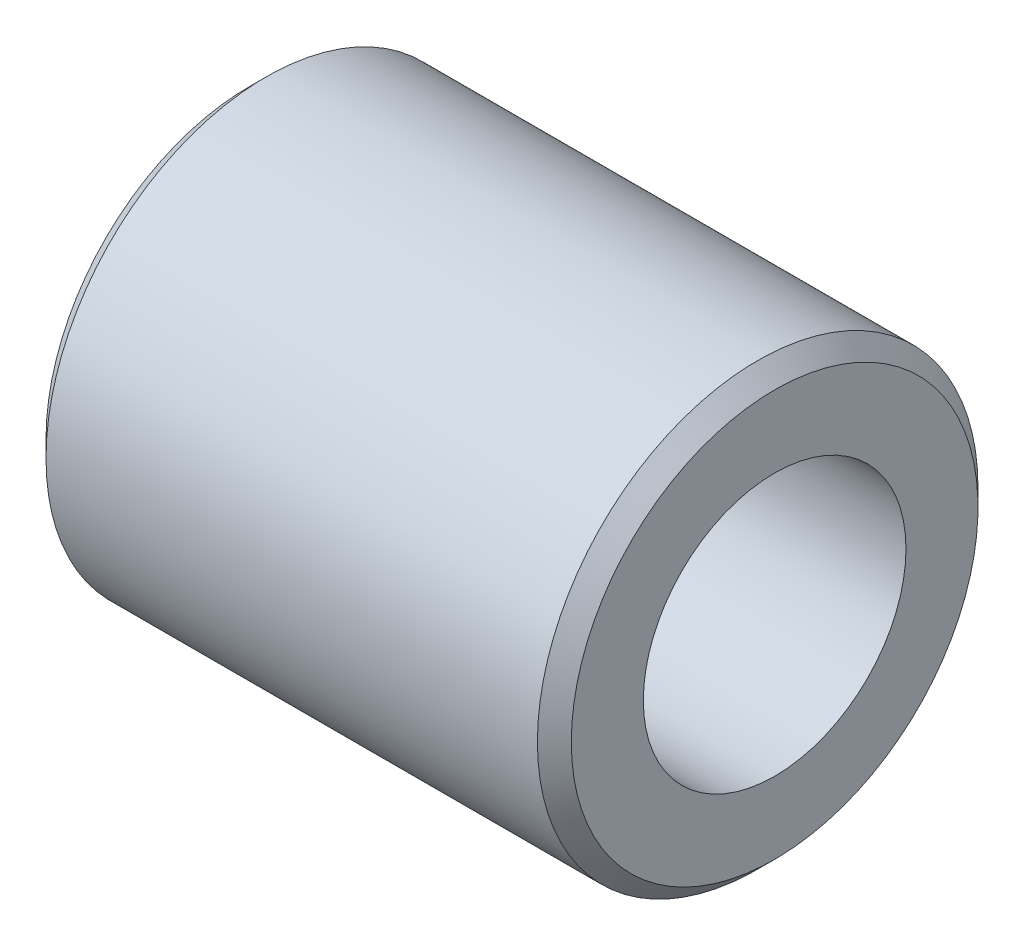
from build123d import *


with BuildPart() as part:
    # Esboço1 → Revolução1 (revolve)
    with BuildSketch(Plane.XY, mode=Mode.PRIVATE) as revolu_o1_sk:
        Polygon((-31, 24), (-29, 26), (29, 26), (31, 24), (31, 15.5), (-31, 15.5), align=None)
    revolve(revolu_o1_sk.sketch.rotate(Axis((-31, 0, 0), (1, 0, 0)), 90), axis=Axis((-31, 0, 0), (1, 0, 0)))


solid = part.part
